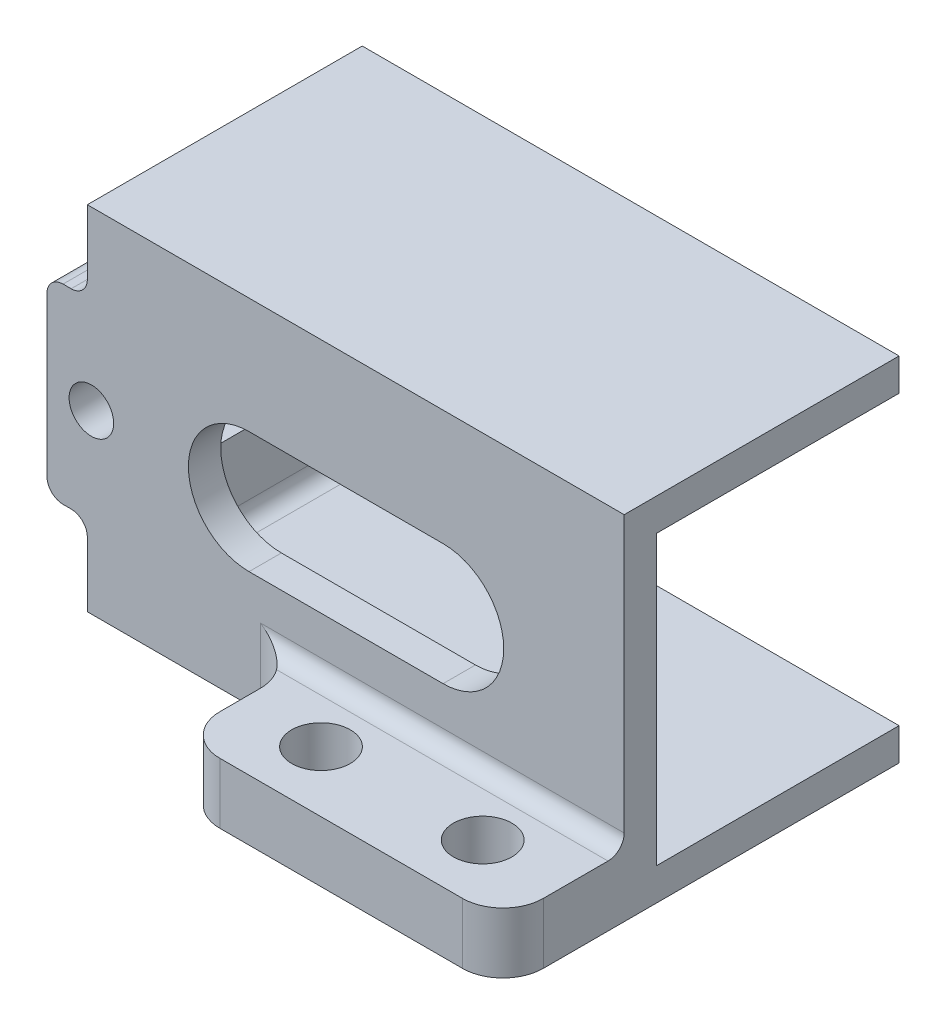
from build123d import *

# Parameters (mm, degrees)
BOSS_EXTRUDE1_DEPTH     = 19.05
SKETCH2_W               = 42.164
SKETCH2_H               = 27.686
BOSS_EXTRUDE2_DEPTH     = 2.54
SKETCH3_W               = 7.0612
SKETCH3_H               = 14.986
BOSS_EXTRUDE3_DEPTH     = 3.175
CUT_EXTRUDE1_DEPTH      = 50.127067096
CUT_EXTRUDE1_DEPTH_BACK = 50.127067096
SKETCH4_R               = 1.75
FILLET2_R               = 1.27
CUT_EXTRUDE2_DEPTH      = 52.65763053
CUT_EXTRUDE2_DEPTH_BACK = 52.65763053
SKETCH5_R               = 4.7625
SKETCH6_W               = 25.4
SKETCH6_H               = 4.7625
BOSS_EXTRUDE4_DEPTH     = 9.525
FILLET3_R               = 3.175
FILLET4_R               = 1.27
FILLET6_R               = 1.27
SKETCH8_R               = 2.3
CUT_EXTRUDE3_DEPTH      = 58.486687197
SKETCH9_W               = 2.54
SKETCH9_H               = 10.16
CUT_EXTRUDE4_DEPTH      = 14.5288
FILLET3_OF_MIRROR2_R    = 3.175
FILLET4_OF_MIRROR2_R    = 1.27
SKETCH11_W              = 43.835439061
SKETCH11_H              = 10.898597795
CUT_EXTRUDE5_DEPTH      = 6.858


with BuildPart() as part:
    # Sketch1 → Boss-Extrude1 (new body)
    with BuildSketch(Plane.XY):
        Polygon((-2.54, 25.146), (39.624, 25.146), (39.624, 22.606), (37.084, 22.606), (0, 22.606), (0, 0), (37.084, 0), (39.624, 0), (39.624, -2.54), (-2.54, -2.54), align=None)
    extrude(amount=BOSS_EXTRUDE1_DEPTH)

    # Sketch2 → Boss-Extrude2 (add)
    with BuildSketch(Plane.XY.offset(19.05)):
        with Locations((18.542, 11.303)):
            Rectangle(SKETCH2_W, SKETCH2_H)
    extrude(amount=BOSS_EXTRUDE2_DEPTH)

    # Sketch3 → Boss-Extrude3 (add)
    with BuildSketch(Plane.ZY.offset(2.54)):
        with Locations((18.0594, 11.303)):
            Rectangle(SKETCH3_W, SKETCH3_H)
    extrude(amount=BOSS_EXTRUDE3_DEPTH)

    # Sketch4 → Cut-Extrude1 (cut, two sides: drawn at the far end of the back side and taken through both)
    with BuildSketch(Plane(origin=(0, 0, 14.5288), x_dir=(-1, 0, 0), z_dir=(0, 0, -1)).offset(-CUT_EXTRUDE1_DEPTH_BACK)):
        with Locations(Location((2.2225, 11.303, 0), (0, 0, 90))):
            Circle(SKETCH4_R)
    extrude(amount=CUT_EXTRUDE1_DEPTH + CUT_EXTRUDE1_DEPTH_BACK, mode=Mode.SUBTRACT)

    # Fillet2
    fillet2_edges = [part.edges().sort_by_distance(p)[0] for p in [
        (-2.54, 18.796, 18.0594),
        (-2.54, 3.81, 18.0594),
        (-5.715, 18.796, 18.0594),
        (-5.715, 3.81, 18.0594),
    ]]
    fillet(fillet2_edges, radius=FILLET2_R)

    # Sketch5 → Cut-Extrude2 (cut, two sides: drawn at the far end of the back side and taken through both)
    with BuildSketch(Plane.XY.offset(21.59).offset(-CUT_EXTRUDE2_DEPTH_BACK)):
        with Locations((10.16, 11.303)):
            Circle(SKETCH5_R)
        with BuildLine():
            Line((25.4, 16.0655), (10.16, 16.0655))
            ThreePointArc((10.16, 16.0655), (13.527596045, 14.670596045), (14.9225, 11.303))
            ThreePointArc((14.9225, 11.303), (13.527596045, 7.935403955), (10.16, 6.5405))
            Line((10.16, 6.5405), (25.4, 6.5405))
            ThreePointArc((25.4, 6.5405), (20.6375, 11.303), (25.4, 16.0655))
        make_face()
        with Locations((25.4, 11.303)):
            Circle(SKETCH5_R)
    extrude(amount=CUT_EXTRUDE2_DEPTH + CUT_EXTRUDE2_DEPTH_BACK, mode=Mode.SUBTRACT)

    # Sketch6 → Boss-Extrude4 (add)
    with BuildSketch(Plane.XY.offset(21.59)):
        with Locations((26.924, 22.76475)):
            Rectangle(SKETCH6_W, SKETCH6_H)
    boss_extrude4 = extrude(amount=BOSS_EXTRUDE4_DEPTH)

    # Fillet3
    fillet3_edges = [part.edges().sort_by_distance(p)[0] for p in [
        (14.224, 22.76475, 21.59),
        (14.224, 22.76475, 31.115),
        (39.624, 22.76475, 31.115),
    ]]
    fillet(fillet3_edges, radius=FILLET3_R)

    # Fillet4
    fillet4_edges = [part.edges().sort_by_distance(p)[0] for p in [
        (25.3365, 20.3835, 21.59),
    ]]
    fillet(fillet4_edges, radius=FILLET4_R)

    # Fillet6
    fillet6_edges = [part.edges().sort_by_distance(p)[0] for p in [
        (0, 0, 9.525),
        (0, 22.606, 9.525),
    ]]
    fillet(fillet6_edges, radius=FILLET6_R)

    # Sketch8 → Cut-Extrude3 (cut, symmetric)
    with BuildSketch(Plane(origin=(0, 25.146, 0), x_dir=(1, 0, 0), z_dir=(0, 1, 0))):
        with Locations(Location((20.574, -26.3525, 0), (0, 0, 270))):
            Circle(SKETCH8_R)
        with Locations(Location((33.274, -26.3525, 0), (0, 0, 270))):
            Circle(SKETCH8_R)
    cut_extrude3 = extrude(amount=CUT_EXTRUDE3_DEPTH, both=True, mode=Mode.SUBTRACT)

    # Sketch9 → Cut-Extrude4 (cut)
    with BuildSketch(Plane(origin=(0, 0, 0), x_dir=(-1, 0, 0), z_dir=(0, 0, -1))):
        with Locations((1.27, 11.303)):
            Rectangle(SKETCH9_W, SKETCH9_H)
    extrude(amount=-CUT_EXTRUDE4_DEPTH, mode=Mode.SUBTRACT)

    # Mirror2: Boss-Extrude4, Cut-Extrude3 across plane
    add(boss_extrude4.mirror(Plane.ZX.offset(11.303)))
    add(cut_extrude3.mirror(Plane.ZX.offset(11.303)), mode=Mode.SUBTRACT)

    # Fillet3 of Mirror2
    fillet3_of_mirror2_edges = [part.edges().sort_by_distance(p)[0] for p in [
        (14.224, -0.15875, 21.59),
        (14.224, -0.15875, 31.115),
        (39.624, -0.15875, 31.115),
    ]]
    fillet(fillet3_of_mirror2_edges, radius=FILLET3_OF_MIRROR2_R)

    # Fillet4 of Mirror2
    fillet4_of_mirror2_edges = [part.edges().sort_by_distance(p)[0] for p in [
        (25.3365, 2.2225, 21.59),
    ]]
    fillet(fillet4_of_mirror2_edges, radius=FILLET4_OF_MIRROR2_R)

    # Sketch11 → Cut-Extrude5 (cut)
    with BuildSketch(Plane(origin=(0, 25.146, 0), x_dir=(1, 0, 0), z_dir=(0, 1, 0))):
        with Locations((19.377719531, -27.039298898)):
            Rectangle(SKETCH11_W, SKETCH11_H)
    extrude(amount=-CUT_EXTRUDE5_DEPTH, mode=Mode.SUBTRACT)


solid = part.part
